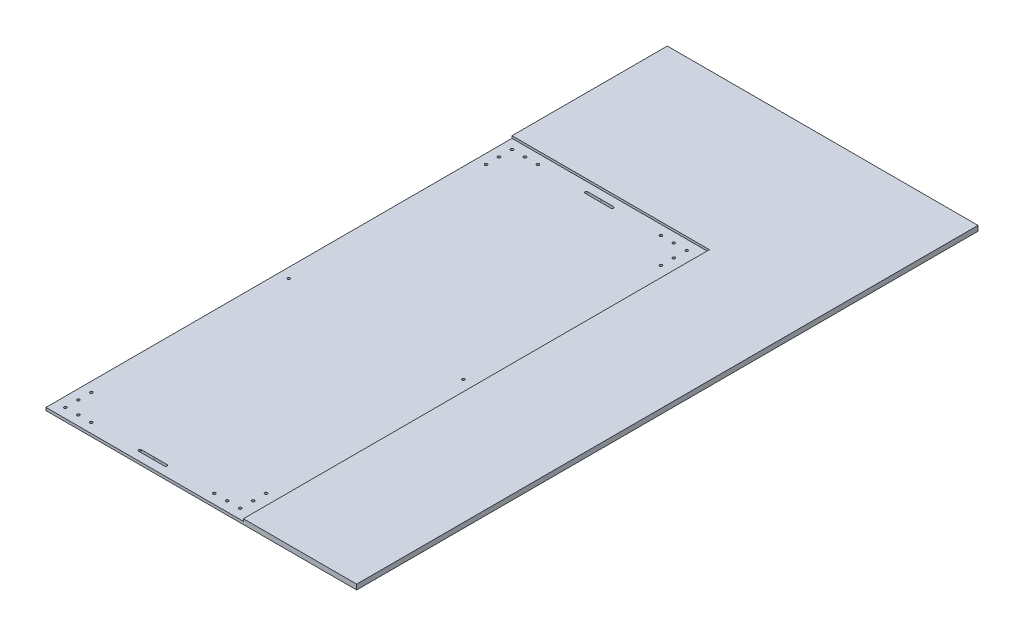
from build123d import *

# Parameters (mm, degrees)
SKETCH1_W                  = 609.6
SKETCH1_H                  = 1219.2
BOSS_EXTRUDE1_DEPTH        = 5.5
BOSS_EXTRUDE2_DEPTH        = 6.35
F_5_3_5_3_DIAMETER_HOLE1_D = 5.3
CUT_EXTRUDE1_REACH         = 1365.159
SKETCH8_R                  = 2.6
CUT_EXTRUDE2_DEPTH         = 994.074837311
BOSS_EXTRUDE3_DEPTH        = 10


with BuildPart() as part:
    # Sketch1 → Boss-Extrude1 (new body)
    with BuildSketch(Plane(origin=(0, 0, 0), x_dir=(1, 0, 0), z_dir=(0, 1, 0))):
        with Locations((304.8, 609.6)):
            Rectangle(SKETCH1_W, SKETCH1_H)
    extrude(amount=BOSS_EXTRUDE1_DEPTH)

    # Sketch3 → Boss-Extrude2 (add)
    with BuildSketch(Plane(origin=(0, 5.5, 0), x_dir=(1, 0, 0), z_dir=(0, 1, 0))):
        Polygon((387.35, 0), (387.35, 914.4), (0, 914.4), (0, 1219.2), (609.6, 1219.2), (609.6, 0), align=None)
    extrude(amount=BOSS_EXTRUDE2_DEPTH)

    # Ø5.3 (5.3) Diameter Hole1 (through all)
    with Locations(Plane(origin=(0, 5.5, 0), x_dir=(1, 0, 0), z_dir=(0, 1, 0))):
        with Locations((19.05, 895.35), (44.45, 895.35), (69.85, 895.35), (19.05, 869.95), (19.05, 844.55), (19.05, 457.2), (19.05, 69.85), (19.05, 44.45), (19.05, 19.05), (44.45, 19.05), (69.85, 19.05), (190.5, 19.05), (311.15, 19.05), (336.55, 19.05), (361.95, 19.05), (361.95, 44.45), (361.95, 69.85), (361.95, 457.2), (361.95, 844.55), (361.95, 869.95), (361.95, 895.35), (336.55, 895.35), (311.15, 895.35), (190.5, 895.35)):
            Hole(F_5_3_5_3_DIAMETER_HOLE1_D / 2)

    # Sketch7 → Cut-Extrude1 (cut, up to next)
    with BuildSketch(Plane(origin=(0, 11.85, 0), x_dir=(1, 0, 0), z_dir=(0, 1, 0)), mode=Mode.PRIVATE) as cut_extrude1_sk1:
        Polygon((0, 1219.2), (0, 914.4), (387.35, 914.4), (387.35, 0), (609.6, 0), (609.6, 1219.2), align=None)
    cut_extrude1_tool1 = extrude(cut_extrude1_sk1.sketch, amount=-CUT_EXTRUDE1_REACH, mode=Mode.PRIVATE) & part.part
    add(cut_extrude1_tool1.solids().sort_by_distance((405.973507, 11.85, -748.352239))[0], mode=Mode.SUBTRACT)

    # Sketch8 → Cut-Extrude2 (cut, through all)
    with BuildSketch(Plane(origin=(0, 5.5, 0), x_dir=(1, 0, 0), z_dir=(0, 1, 0))):
        with Locations((190.5, 19.05)):
            Circle(SKETCH8_R)
        with BuildLine():
            Line((215.9, 21.65), (191.012347538, 21.65))
            ThreePointArc((191.012347538, 21.65), (193.15, 19.05), (191.012347538, 16.45))
            Line((191.012347538, 16.45), (215.9, 16.45))
            ThreePointArc((215.9, 16.45), (218.5, 19.05), (215.9, 21.65))
        make_face()
        with BuildLine():
            ThreePointArc((189.987652462, 16.45), (187.85, 19.05), (189.987652462, 21.65))
            Line((189.987652462, 21.65), (165.1, 21.65))
            ThreePointArc((165.1, 21.65), (162.5, 19.05), (165.1, 16.45))
            Line((165.1, 16.45), (189.987652462, 16.45))
        make_face()
        with BuildLine():
            ThreePointArc((165.1, 897.95), (162.5, 895.35), (165.1, 892.75))
            Line((165.1, 892.75), (189.987652462, 892.75))
            ThreePointArc((189.987652462, 892.75), (187.85, 895.35), (189.987652462, 897.95))
            Line((189.987652462, 897.95), (165.1, 897.95))
        make_face()
        with Locations((190.5, 895.35)):
            Circle(SKETCH8_R)
        with BuildLine():
            ThreePointArc((191.012347538, 897.95), (193.15, 895.35), (191.012347538, 892.75))
            Line((191.012347538, 892.75), (215.9, 892.75))
            ThreePointArc((215.9, 892.75), (218.5, 895.35), (215.9, 897.95))
            Line((215.9, 897.95), (191.012347538, 897.95))
        make_face()
    extrude(amount=-CUT_EXTRUDE2_DEPTH, mode=Mode.SUBTRACT)

    # Sketch9 → Boss-Extrude3 (add)
    with BuildSketch(Plane.XZ):
        Polygon((0, -1219.2), (609.6, -1219.2), (609.6, 0), (387.35, 0), (387.35, -914.4), (0, -914.4), align=None)
    extrude(amount=-BOSS_EXTRUDE3_DEPTH)


solid = part.part
